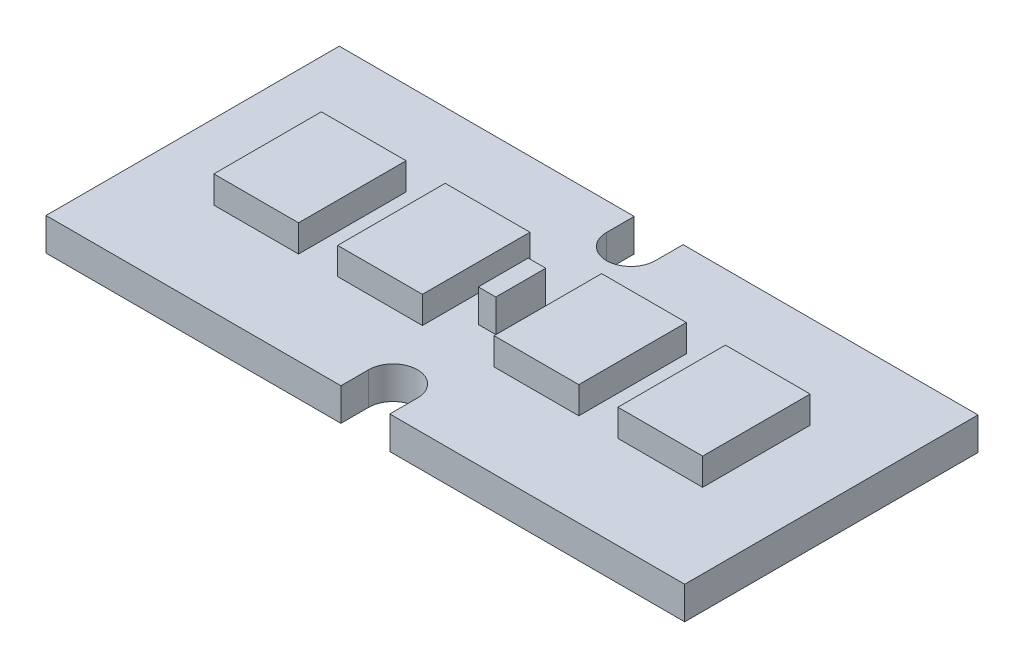
from build123d import *

# Parameters (mm, degrees)
SKETCH_1_W          = 19.6
SKETCH_1_H          = 9
EXTRUDE_1_DEPTH     = 1
CUT_EXTRUDE_1_DEPTH = 11.830050785
SKETCH_4_W          = 2.6
SKETCH_4_H          = 1.65
SKETCH_4_H_2        = 3.3
EXTRUDE_2_DEPTH     = 0.83
SKETCH_3_W          = 0.537571624
SKETCH_3_H          = 1.530011548
EXTRUDE_3_DEPTH     = 1


with BuildPart() as part:
    # 草图1 → 凸台-拉伸1 (new body)
    with BuildSketch(Plane(origin=(0, 0, 0), x_dir=(1, 0, 0), z_dir=(0, 1, 0))):
        Rectangle(SKETCH_1_W, SKETCH_1_H)
    extrude(amount=EXTRUDE_1_DEPTH)

    # 草图2 → 切除-拉伸1 (cut, through all)
    with BuildSketch(Plane(origin=(0, 1, 0), x_dir=(1, 0, 0), z_dir=(0, 1, 0))):
        with BuildLine():
            Line((0.75, 4.5), (-0.75, 4.5))
            Line((-0.75, 4.5), (-0.75, 3.65))
            ThreePointArc((-0.75, 3.65), (0, 4.4), (0.75, 3.65))
            Line((0.75, 3.65), (0.75, 4.5))
        make_face()
        with BuildLine():
            ThreePointArc((0.75, 3.65), (0, 4.4), (-0.75, 3.65))
            Line((-0.75, 3.65), (0.75, 3.65))
        make_face()
        with BuildLine():
            Line((0.75, 3.65), (-0.75, 3.65))
            ThreePointArc((-0.75, 3.65), (0, 2.9), (0.75, 3.65))
        make_face()
        with BuildLine():
            ThreePointArc((0.75, -3.65), (0, -2.9), (-0.75, -3.65))
            Line((-0.75, -3.65), (0.75, -3.65))
        make_face()
        with BuildLine():
            Line((0.75, -3.65), (-0.75, -3.65))
            ThreePointArc((-0.75, -3.65), (0, -4.4), (0.75, -3.65))
        make_face()
        with BuildLine():
            ThreePointArc((0.75, -3.65), (0, -4.4), (-0.75, -3.65))
            Line((-0.75, -3.65), (-0.75, -4.5))
            Line((-0.75, -4.5), (0.75, -4.5))
            Line((0.75, -4.5), (0.75, -3.65))
        make_face()
    extrude(amount=-CUT_EXTRUDE_1_DEPTH, mode=Mode.SUBTRACT)

    # 草图4 → 凸台-拉伸2 (add)
    with BuildSketch(Plane(origin=(0, 1, 0), x_dir=(1, 0, 0), z_dir=(0, 1, 0))):
        with Locations((-6.2, 0.825)):
            Rectangle(SKETCH_4_W, SKETCH_4_H)
        with Locations((-6.2, -0.825)):
            Rectangle(SKETCH_4_W, SKETCH_4_H)
        with Locations((-2.4, 0.825)):
            Rectangle(SKETCH_4_W, SKETCH_4_H)
        with Locations((-2.4, -0.825)):
            Rectangle(SKETCH_4_W, SKETCH_4_H)
        with Locations((2.4, 0)):
            Rectangle(SKETCH_4_W, SKETCH_4_H_2)
        with Locations((6.2, 0)):
            Rectangle(SKETCH_4_W, SKETCH_4_H_2)
    extrude(amount=EXTRUDE_2_DEPTH)

    # 草图3 → 凸台-拉伸3 (add)
    with BuildSketch(Plane(origin=(0, 1, 0), x_dir=(1, 0, 0), z_dir=(0, 1, 0))):
        Rectangle(SKETCH_3_W, SKETCH_3_H)
    extrude(amount=EXTRUDE_3_DEPTH)


solid = part.part
